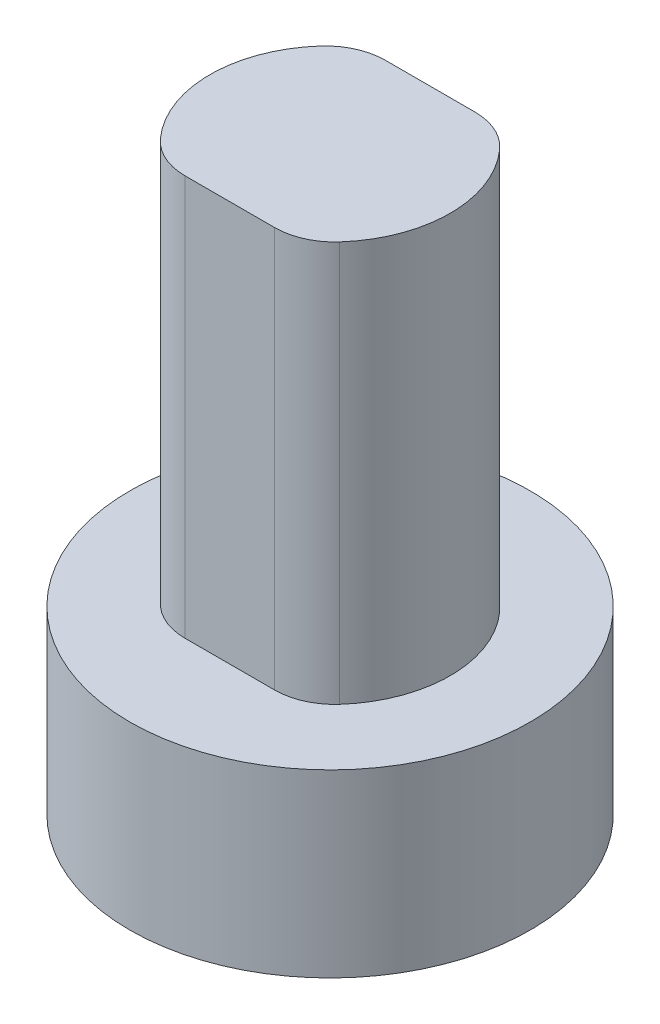
from build123d import *

# Parameters (mm, degrees)
SKETCH1_R              = 10
SKETCH1_R_2            = 4
BOSS_EXTRUDE1_DEPTH    = 9
BOSS_EXTRUDE2_DEPTH    = 20
SKETCH5_R              = 4
CUT_EXTRUDE3_DEPTH     = 13
FILLET1_R              = 3
M4_TAPPED_HOLE1_REACH  = 35.17
M4_TAPPED_HOLE1_BORE_R = 1.65
CIRPATTERN1_COUNT      = 2
CIRPATTERN1_ANGLE      = 120


with BuildPart() as part:
    # Sketch1 → Boss-Extrude1 (new body)
    with BuildSketch(Plane(origin=(0, 0, 0), x_dir=(1, 0, 0), z_dir=(0, 1, 0))):
        with Locations(Location((0, 0, 0), (0, 0, 270))):
            Circle(SKETCH1_R)
        with Locations(Location((0, 0, 0), (0, 0, 270))):
            Circle(SKETCH1_R_2, mode=Mode.SUBTRACT)
    extrude(amount=BOSS_EXTRUDE1_DEPTH)

    # Sketch4 → Boss-Extrude2 (add)
    with BuildSketch(Plane(origin=(0, 9, 0), x_dir=(1, 0, 0), z_dir=(0, 1, 0))):
        with BuildLine():
            Line((-3.31662479, -5), (3.31662479, -5))
            ThreePointArc((3.31662479, -5), (6, 0), (3.31662479, 5))
            Line((3.31662479, 5), (-3.31662479, 5))
            ThreePointArc((-3.31662479, 5), (-6, 0), (-3.31662479, -5))
        make_face()
    extrude(amount=BOSS_EXTRUDE2_DEPTH)

    # Sketch5 → Cut-Extrude3 (cut)
    with BuildSketch(Plane.XZ.offset(-9)):
        with Locations(Location((0, 0, 0), (0, 0, 270))):
            Circle(SKETCH5_R)
    extrude(amount=-CUT_EXTRUDE3_DEPTH, mode=Mode.SUBTRACT)

    # Fillet1
    fillet1_edges = [part.edges().sort_by_distance(p)[0] for p in [
        (3.31662479, 19, 5),
        (3.31662479, 19, -5),
        (-3.31662479, 19, -5),
        (-3.31662479, 19, 5),
    ]]
    fillet(fillet1_edges, radius=FILLET1_R)

    # M4 Tapped Hole1 bore (on position points) → M4 Tapped Hole1 (cut, up to next)
    with BuildSketch(Plane(origin=(0, 4.5, -10), x_dir=(-1, 0, 0), z_dir=(0, 0, -1)), mode=Mode.PRIVATE) as m4_tapped_hole1_sk1:
        Circle(M4_TAPPED_HOLE1_BORE_R)
    m4_tapped_hole1_tool1 = extrude(m4_tapped_hole1_sk1.sketch, amount=-M4_TAPPED_HOLE1_REACH, mode=Mode.PRIVATE) & part.part
    m4_tapped_hole1 = m4_tapped_hole1_tool1.solids().sort_by_distance((0, 4.5, -10))[0]
    add(m4_tapped_hole1, mode=Mode.SUBTRACT)

    # CirPattern1: M4 Tapped Hole1 ×2 about axis
    cirpattern1_axis = Axis((0, 9, 0), (0, 1, 0))
    for i in range(1, CIRPATTERN1_COUNT):
        add(m4_tapped_hole1.rotate(cirpattern1_axis, i * CIRPATTERN1_ANGLE / (CIRPATTERN1_COUNT - 1)), mode=Mode.SUBTRACT)


solid = part.part
